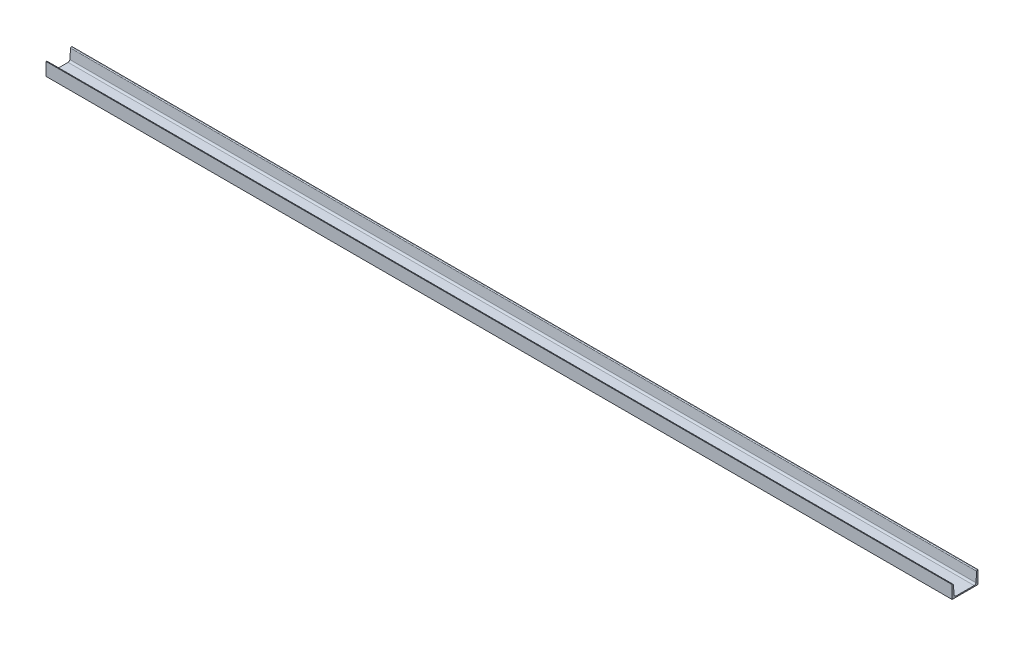
from build123d import *

# Parameters (mm, degrees)
C_KANAL_C_150_X_75_X_6_5_1_DEPTH = 5250


with BuildPart() as part:
    # Sketch1 → C kanal C 150 X 75 X 6.5(1) (new body)
    with BuildSketch(Plane.YZ):
        with BuildLine():
            Line((75, 150), (0, 150))
            Line((0, 150), (0, 0))
            Line((0, 0), (75, 0))
            Line((75, 0), (75, 2.421857404))
            ThreePointArc((75, 2.421857404), (73.686386684, 5.799808442), (70.435778714, 7.402830895))
            Line((70.435778714, 7.402830895), (15.628442573, 12.197851485))
            ThreePointArc((15.628442573, 12.197851485), (9.127226632, 15.40389639), (6.5, 22.159798466))
            Line((6.5, 22.159798466), (6.5, 127.840201534))
            ThreePointArc((6.5, 127.840201534), (9.127226632, 134.59610361), (15.628442573, 137.802148515))
            Line((15.628442573, 137.802148515), (70.435778714, 142.597169105))
            ThreePointArc((70.435778714, 142.597169105), (73.686386684, 144.200191558), (75, 147.578142596))
            Line((75, 147.578142596), (75, 150))
        make_face()
    extrude(amount=C_KANAL_C_150_X_75_X_6_5_1_DEPTH)


solid = part.part
